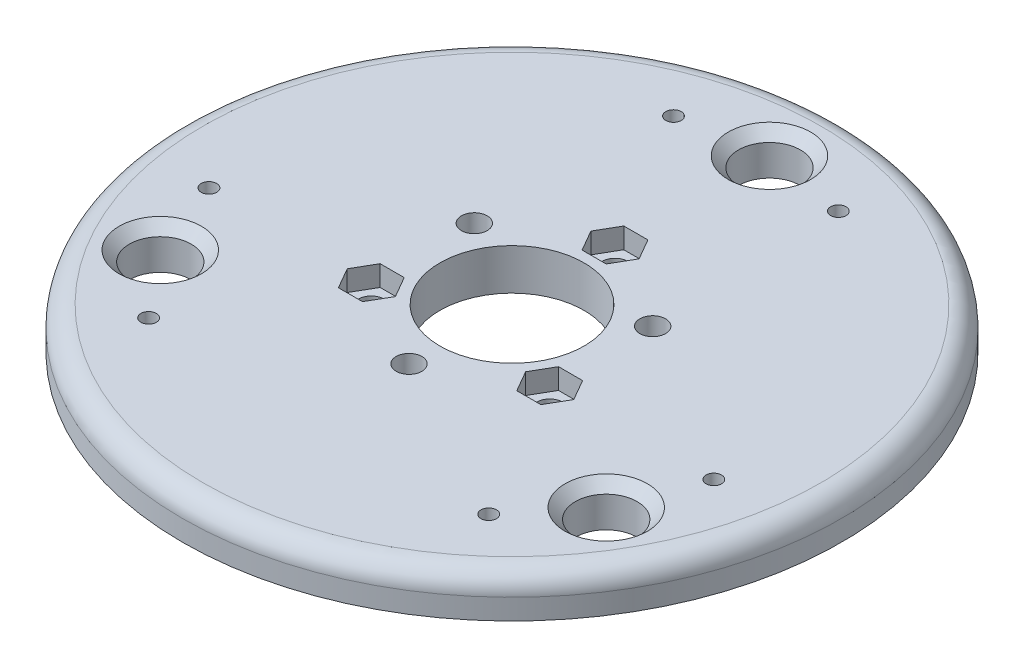
from build123d import *

# Parameters (mm, degrees)
SKETCH_1_R          = 32
SKETCH_1_R_2        = 7
SKETCH_1_R_3        = 3
EXTRUDE_1_DEPTH     = 4
FILLET_1_R          = 2
SKETCH_2_R          = 1.25
CUT_EXTRUDE_1_DEPTH = 46.431266766
CUT_EXTRUDE_2_DEPTH = 2
CUT_EXTRUDE_3_DEPTH = 2
CHAMFER_1_SIZE      = 1
SKETCH_5_R          = 0.75
CUT_EXTRUDE_4_DEPTH = 46.431266766


with BuildPart() as part:
    # Эскиз1 → Бобышка-Вытянуть1 (new body)
    with BuildSketch(Plane(origin=(0, 0, 0), x_dir=(1, 0, 0), z_dir=(0, 1, 0))):
        with Locations(Location((0, 0, 0), (0, 0, 270))):
            Circle(SKETCH_1_R)
        with Locations(Location((0, 0, 0), (0, 0, 270))):
            Circle(SKETCH_1_R_2, mode=Mode.SUBTRACT)
        with Locations(Location((0, 25, 0), (0, 0, 270))):
            Circle(SKETCH_1_R_3, mode=Mode.SUBTRACT)
        with Locations(Location((21.650635095, -12.5, 0), (0, 0, 270))):
            Circle(SKETCH_1_R_3, mode=Mode.SUBTRACT)
        with Locations(Location((-21.650635095, -12.5, 0), (0, 0, 270))):
            Circle(SKETCH_1_R_3, mode=Mode.SUBTRACT)
    extrude(amount=EXTRUDE_1_DEPTH)

    # Скругление1
    fillet_1_edges = [part.edges().sort_by_distance(p)[0] for p in [
        (0, 4, -32),
    ]]
    fillet(fillet_1_edges, radius=FILLET_1_R)

    # Эскиз2 → Вырез-Вытянуть1 (cut, through all)
    with BuildSketch(Plane(origin=(0, 4, 0), x_dir=(1, 0, 0), z_dir=(0, 1, 0))):
        with Locations(Location((0, 10, 0), (0, 0, 270))):
            Circle(SKETCH_2_R)
        with Locations(Location((8.660254038, 5, 0), (0, 0, 270))):
            Circle(SKETCH_2_R)
        with Locations(Location((8.660254038, -5, 0), (0, 0, 270))):
            Circle(SKETCH_2_R)
        with Locations(Location((0, -10, 0), (0, 0, 270))):
            Circle(SKETCH_2_R)
        with Locations(Location((-8.660254038, -5, 0), (0, 0, 270))):
            Circle(SKETCH_2_R)
        with Locations(Location((-8.660254038, 5, 0), (0, 0, 270))):
            Circle(SKETCH_2_R)
    extrude(amount=-CUT_EXTRUDE_1_DEPTH, mode=Mode.SUBTRACT)

    # Эскиз3 → Вырез-Вытянуть2 (cut)
    with BuildSketch(Plane(origin=(0, 4, 0), x_dir=(1, 0, 0), z_dir=(0, 1, 0))):
        Polygon((9.829388333, -7.025), (10.998522628, -5), (9.829388333, -2.975), (7.491119743, -2.975), (6.321985448, -5), (7.491119743, -7.025), align=None)
        Polygon((1.169134295, 7.975), (2.33826859, 10), (1.169134295, 12.025), (-1.169134295, 12.025), (-2.33826859, 10), (-1.169134295, 7.975), align=None)
        Polygon((-10.998522628, -5), (-9.829388333, -7.025), (-7.491119743, -7.025), (-6.321985448, -5), (-7.491119743, -2.975), (-9.829388333, -2.975), align=None)
    extrude(amount=-CUT_EXTRUDE_2_DEPTH, mode=Mode.SUBTRACT)

    # Эскиз4 → Вырез-Вытянуть3 (cut)
    with BuildSketch(Plane.XZ):
        Polygon((7.491119743, -7.025), (9.829388333, -7.025), (10.998522628, -5), (9.829388333, -2.975), (7.491119743, -2.975), (6.321985448, -5), align=None)
        Polygon((-1.169134295, 7.975), (1.169134295, 7.975), (2.33826859, 10), (1.169134295, 12.025), (-1.169134295, 12.025), (-2.33826859, 10), align=None)
        Polygon((-9.829388333, -2.975), (-10.998522628, -5), (-9.829388333, -7.025), (-7.491119743, -7.025), (-6.321985448, -5), (-7.491119743, -2.975), align=None)
    extrude(amount=-CUT_EXTRUDE_3_DEPTH, mode=Mode.SUBTRACT)

    # Фаска1
    chamfer_1_edges = [part.edges().sort_by_distance(p)[0] for p in [
        (21.650635095, 4, 9.5),
        (-21.650635095, 4, 9.5),
        (0, 4, -28),
    ]]
    chamfer(chamfer_1_edges, length=CHAMFER_1_SIZE)

    # Эскиз5 → Вырез-Вытянуть4 (cut, through all)
    with BuildSketch(Plane(origin=(0, 4, 0), x_dir=(1, 0, 0), z_dir=(0, 1, 0))):
        with Locations(Location((8, 23.685438565, 0), (0, 0, 270))):
            Circle(SKETCH_5_R)
        with Locations(Location((-8, 23.685438565, 0), (0, 0, 270))):
            Circle(SKETCH_5_R)
        with Locations(Location((24.512191497, -4.914516052, 0), (0, 0, 270))):
            Circle(SKETCH_5_R)
        with Locations(Location((16.512191497, -18.770922513, 0), (0, 0, 270))):
            Circle(SKETCH_5_R)
        with Locations(Location((-16.512191497, -18.770922513, 0), (0, 0, 270))):
            Circle(SKETCH_5_R)
        with Locations(Location((-24.512191497, -4.914516052, 0), (0, 0, 270))):
            Circle(SKETCH_5_R)
    extrude(amount=-CUT_EXTRUDE_4_DEPTH, mode=Mode.SUBTRACT)


solid = part.part
